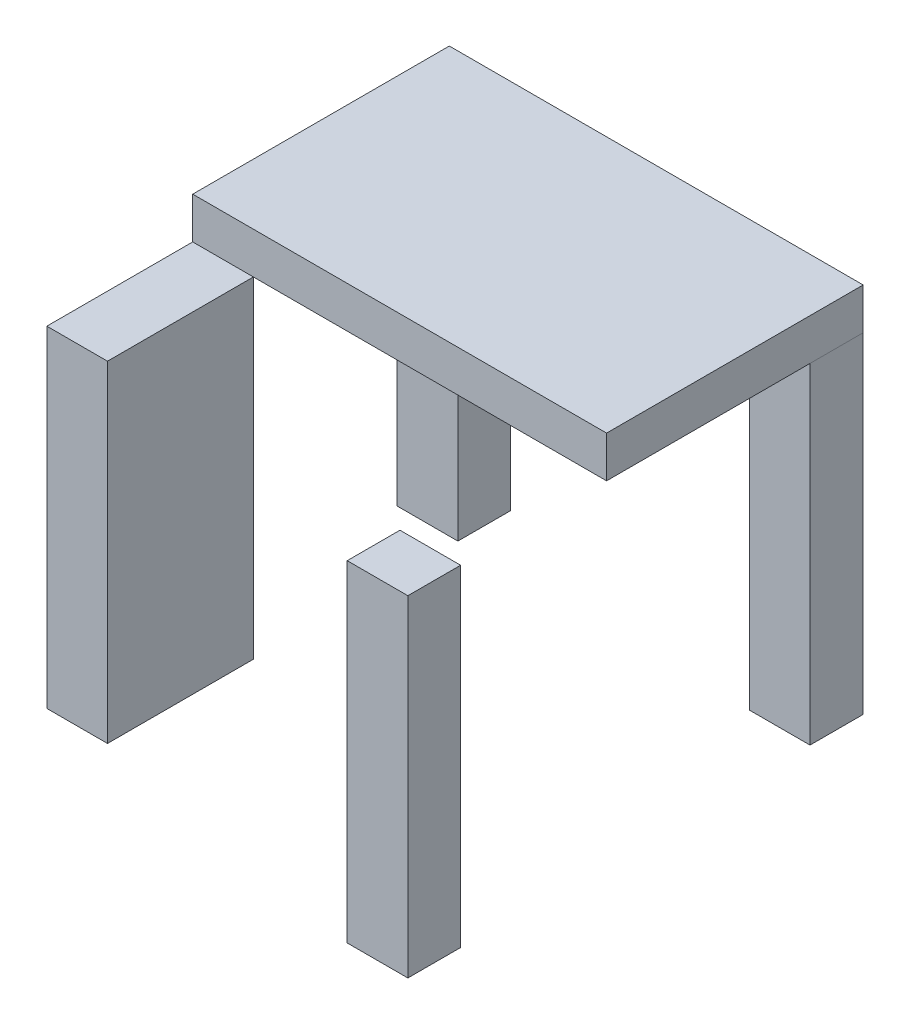
from build123d import *

# Parameters (mm, degrees)
SKETCH1_W           = 100
SKETCH1_H           = 10
BOSS_EXTRUDE1_DEPTH = 62
SKETCH2_W           = 14.657296337
SKETCH2_H           = 12.750406224
SKETCH2_H_2         = 35.249593776
SKETCH2_W_2         = 14.657296336
BOSS_EXTRUDE2_DEPTH = 80


with BuildPart() as part:
    # Sketch1 → Boss-Extrude1 (new body)
    with BuildSketch(Plane.XY):
        with Locations((50, 5)):
            Rectangle(SKETCH1_W, SKETCH1_H)
    extrude(amount=BOSS_EXTRUDE1_DEPTH)

    # Sketch2 → Boss-Extrude2 (add)
    with BuildSketch(Plane.XZ):
        with Locations((92.690459103, 103.659485129)):
            Rectangle(SKETCH2_W, SKETCH2_H)
        with Locations((7.328648169, 79.624796888)):
            Rectangle(SKETCH2_W, SKETCH2_H_2)
        with Locations((7.309540898, 6.193559762)):
            Rectangle(SKETCH2_W, SKETCH2_H)
        with Locations((92.543503994, 6.340514871)):
            Rectangle(SKETCH2_W_2, SKETCH2_H)
    extrude(amount=BOSS_EXTRUDE2_DEPTH)


with BuildPart() as boss_extrude2_piece_1:
    # of the separate pieces the step leaves, piece 1, a body of its own (boss_extrude2_pieces)
    add(part.part.solids().sort_by_distance((0, 0, 12.568762874))[0])


with BuildPart() as boss_extrude2_piece_2:
    # of the separate pieces the step leaves, piece 2, a body of its own (boss_extrude2_pieces)
    add(part.part.solids().sort_by_distance((0, -80, 62))[0])


with BuildPart() as boss_extrude2_piece_3:
    # of the separate pieces the step leaves, piece 3, a body of its own (boss_extrude2_pieces)
    add(part.part.solids().sort_by_distance((85.361810934, 0, 110.034688241))[0])


solid = Compound([boss_extrude2_piece_1.part, boss_extrude2_piece_2.part, boss_extrude2_piece_3.part])
